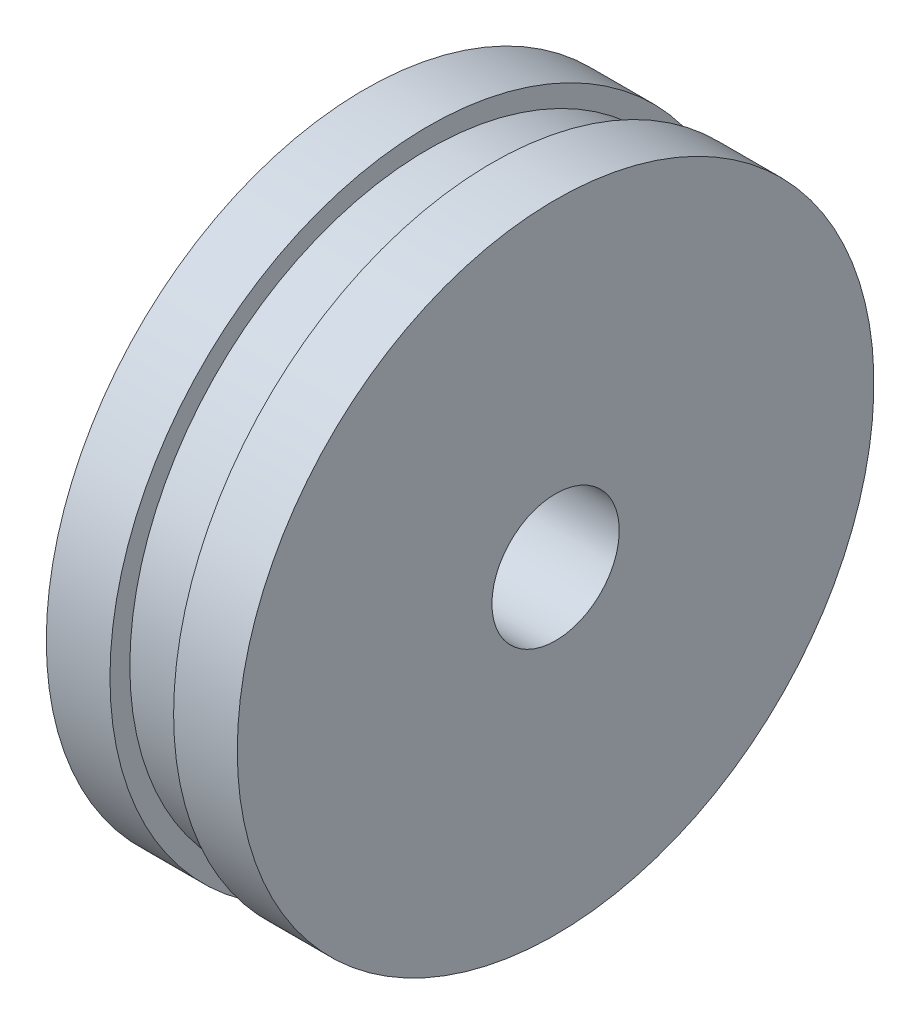
from build123d import *

# Parameters (mm, degrees)
SKETCH2_R          = 4
CUT_EXTRUDE1_DEPTH = 40


with BuildPart() as part:
    # Sketch1 → Revolve1 (revolve)
    with BuildSketch(Plane(origin=(0, 0, 0), x_dir=(1, 0, 0), z_dir=(0, 1, 0)), mode=Mode.PRIVATE) as revolve1_sk:
        Polygon((6, 0), (-6, 0), (-6, 20), (-2, 20), (-2, 18.75), (2, 18.75), (2, 20), (6, 20), align=None)
    revolve(revolve1_sk.sketch.rotate(Axis((-28.819039277, 0, 0), (1, 0, 0)), 180), axis=Axis((-28.819039277, 0, 0), (1, 0, 0)))

    # Sketch2 → Cut-Extrude1 (cut)
    with BuildSketch(Plane.ZY.offset(6)):
        Circle(SKETCH2_R)
    extrude(amount=-CUT_EXTRUDE1_DEPTH, mode=Mode.SUBTRACT)


solid = part.part
